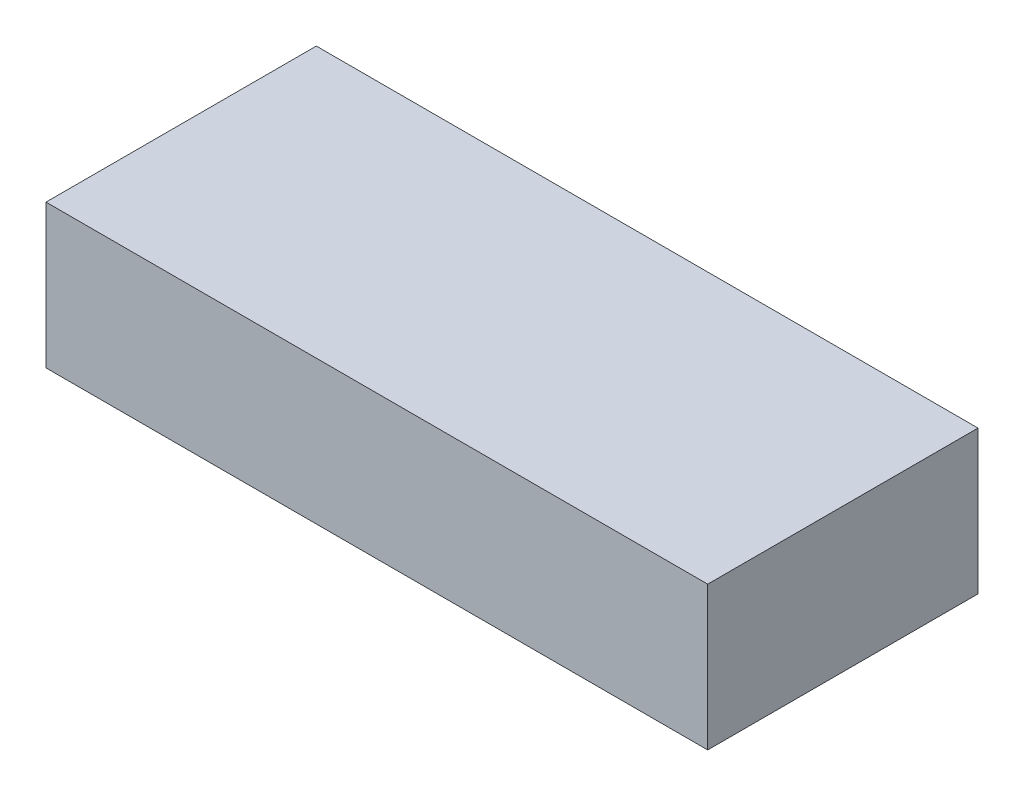
from build123d import *

# Parameters (mm, degrees)
SKETCH_1_W      = 235
SKETCH_1_H      = 51
EXTRUDE_1_DEPTH = 96


with BuildPart() as part:
    # ｽｹｯﾁ1 → ﾎﾞｽ - 押し出し1 (new body)
    with BuildSketch(Plane.XY):
        Rectangle(SKETCH_1_W, SKETCH_1_H)
    extrude(amount=EXTRUDE_1_DEPTH)


solid = part.part
